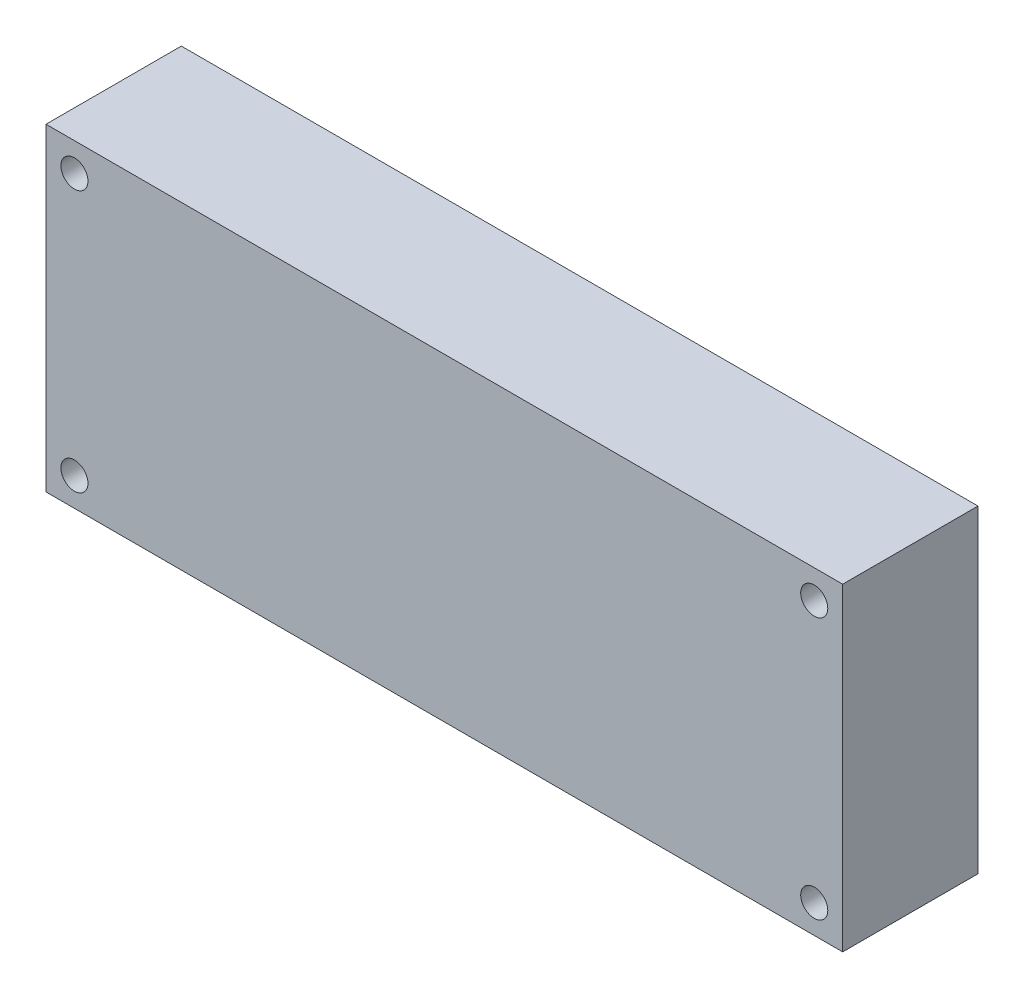
from build123d import *

# Parameters (mm, degrees)
SKETCH_1_W      = 88.3
SKETCH_1_H      = 35.3
SKETCH_1_R      = 1.5
EXTRUDE_1_DEPTH = 15


with BuildPart() as part:
    # 草圖1 → 伸長1 (new body)
    with BuildSketch(Plane.XY):
        Rectangle(SKETCH_1_W, SKETCH_1_H)
        with Locations((-41, 14.5)):
            Circle(SKETCH_1_R, mode=Mode.SUBTRACT)
        with Locations((-41, -14.5)):
            Circle(SKETCH_1_R, mode=Mode.SUBTRACT)
        with Locations((41, -14.5)):
            Circle(SKETCH_1_R, mode=Mode.SUBTRACT)
        with Locations((41, 14.5)):
            Circle(SKETCH_1_R, mode=Mode.SUBTRACT)
    extrude(amount=EXTRUDE_1_DEPTH)


solid = part.part
